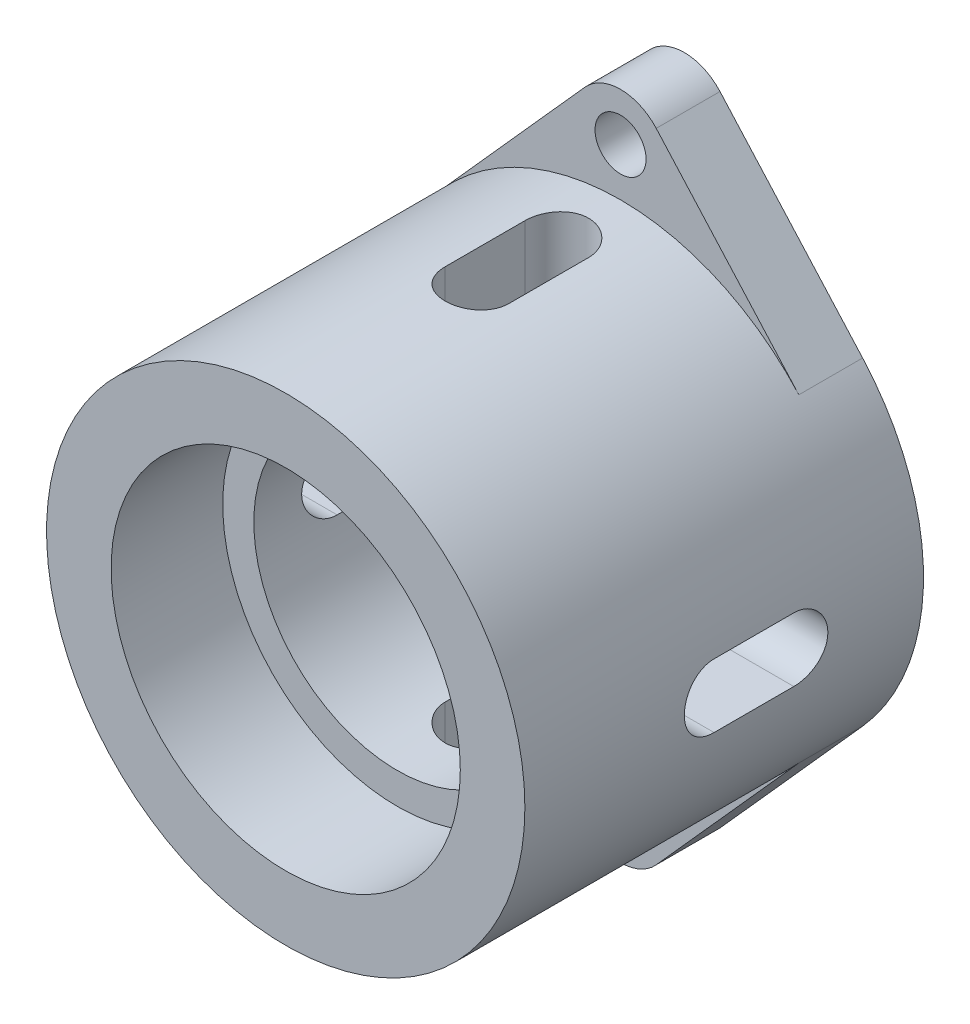
from build123d import *

# Parameters (mm, degrees)
CROQUIS1_R              = 15
CROQUIS1_R_2            = 9
SALIENTE_EXTRUIR1_DEPTH = 25
CROQUIS2_R              = 10.95
CORTAR_EXTRUIR1_DEPTH   = 7
CROQUIS3_R              = 1.6
SALIENTE_EXTRUIR2_DEPTH = 4
CORTAR_EXTRUIR2_DEPTH   = 26
MATRIZC1_COUNT          = 4


with BuildPart() as part:
    # Croquis1 → Saliente-Extruir1 (new body)
    with BuildSketch(Plane(origin=(0, 0, 0), x_dir=(0, 1, 0), z_dir=(0, 0, 1))):
        with Locations(Location((0, 0, 0), (0, 0, 270))):
            Circle(CROQUIS1_R)
        with Locations(Location((0, 0, 0), (0, 0, 270))):
            Circle(CROQUIS1_R_2, mode=Mode.SUBTRACT)
    extrude(amount=SALIENTE_EXTRUIR1_DEPTH)

    # Croquis2 → Cortar-Extruir1 (cut)
    with BuildSketch(Plane.XY.offset(25)):
        Circle(CROQUIS2_R)
    extrude(amount=-CORTAR_EXTRUIR1_DEPTH, mode=Mode.SUBTRACT)

    # Croquis3 → Saliente-Extruir2 (add)
    with BuildSketch(Plane(origin=(0, 0, 0), x_dir=(0, 1, 0), z_dir=(0, 0, 1))):
        with BuildLine():
            Line((-20.000196267, -2.236419092), (-9.999672874, -11.180632469))
            ThreePointArc((-9.999672874, -11.180632469), (-15, 0), (-9.999672874, 11.180632469))
            Line((-9.999672874, 11.180632469), (-20.000196267, 2.236419092))
            ThreePointArc((-20.000196267, 2.236419092), (-21.000392551, 0), (-20.000196267, -2.236419092))
        make_face()
        with Locations(Location((-18, 0, 0), (0, 0, 270))):
            Circle(CROQUIS3_R, mode=Mode.SUBTRACT)
    saliente_extruir2 = extrude(amount=SALIENTE_EXTRUIR2_DEPTH)

    # Simetría1: Saliente-Extruir2 across plane
    add(saliente_extruir2.mirror(Plane.ZX))

    # Croquis4 → Cortar-Extruir2 (cut)
    with BuildSketch(Plane.YZ):
        with BuildLine():
            Line((-2, 8), (-2, 13))
            ThreePointArc((-2, 13), (0, 15), (2, 13))
            Line((2, 13), (2, 8))
            ThreePointArc((2, 8), (0, 6), (-2, 8))
        make_face()
    cortar_extruir2 = extrude(amount=-CORTAR_EXTRUIR2_DEPTH, mode=Mode.SUBTRACT)

    # MatrizC1: Cortar-Extruir2 ×4 about axis
    matrizc1_axis = Axis((0, 0, 0), (0, 0, 1))
    for i in range(1, MATRIZC1_COUNT):
        add(cortar_extruir2.rotate(matrizc1_axis, i * 360 / MATRIZC1_COUNT), mode=Mode.SUBTRACT)


solid = part.part
